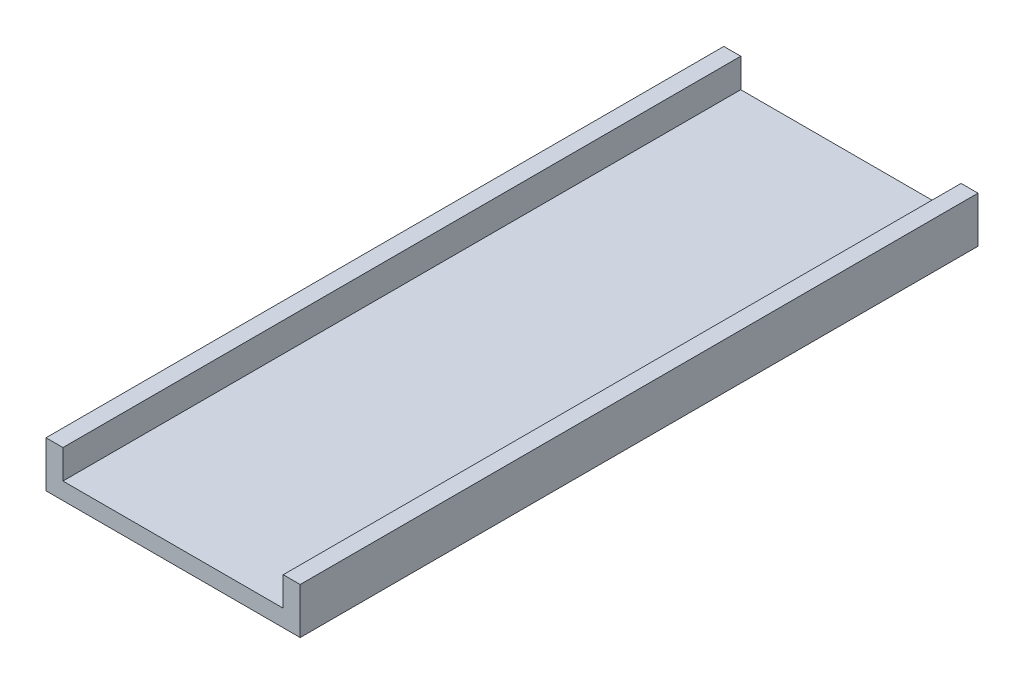
from build123d import *

# Parameters (mm, degrees)
BOSS_EXTRU_1_DEPTH      = 95
ESQUISSE2_W             = 15
ESQUISSE2_H             = 5.425563258
ENL_V_MAT_EXTRU_1_DEPTH = 46


with BuildPart() as part:
    # Esquisse1 → Boss.-Extru.1 (new body)
    with BuildSketch(Plane.XY):
        Polygon((-27.258684463, 5.425563258), (-27.258684463, 0), (2.741315537, 0), (2.741315537, 5.425563258), (0.741315537, 5.425563258), (0.741315537, 2), (-25.258684463, 2), (-25.258684463, 5.425563258), align=None)
    extrude(amount=BOSS_EXTRU_1_DEPTH)

    # Esquisse2 → Enlèv. mat.-Extru.1 (cut)
    with BuildSketch(Plane(origin=(2.741315537, 0, 0), x_dir=(0, 0, -1), z_dir=(1, 0, 0))):
        with Locations((-87.5, 2.712781629)):
            Rectangle(ESQUISSE2_W, ESQUISSE2_H)
    extrude(amount=-ENL_V_MAT_EXTRU_1_DEPTH, mode=Mode.SUBTRACT)


solid = part.part
